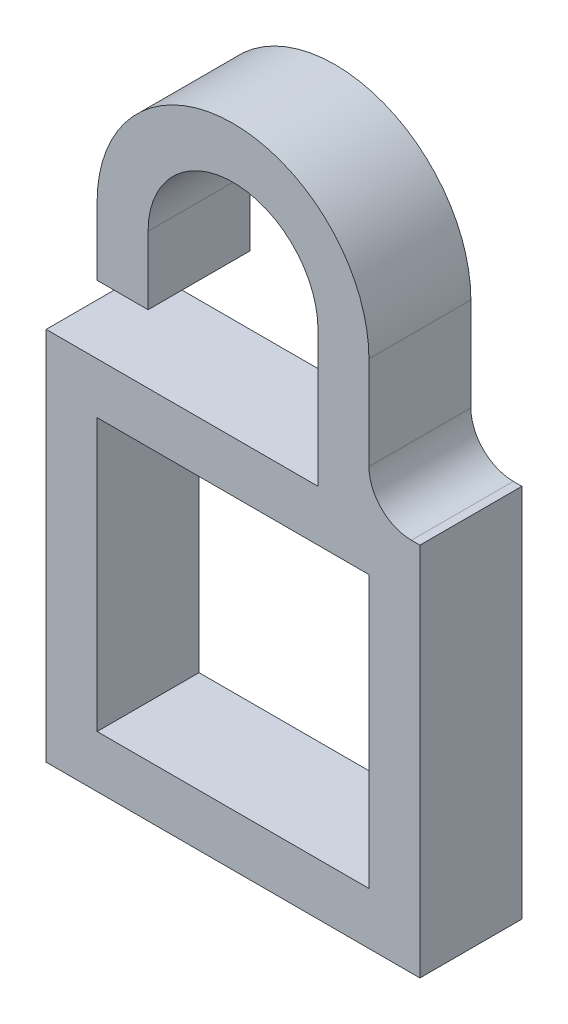
from build123d import *

# Parameters (mm, degrees)
EXTRUDE_1_DEPTH = 12
FILLET_1_R      = 5


with BuildPart() as part:
    # 草图1 → 凸台-拉伸1 (new body)
    with BuildSketch(Plane.XY):
        with BuildLine():
            Line((-16, -8), (-10, -8))
            Line((-10, -8), (-10, 0))
            ThreePointArc((-10, 0), (0, 10), (10, 0))
            Line((10, 0), (10, -16))
            Line((10, -16), (16, -16))
            Line((16, -16), (16, 0))
            ThreePointArc((16, 0), (0, 16), (-16, 0))
            Line((-16, 0), (-16, -8))
        make_face()
        Polygon((16, -16), (10, -16), (-10, -16), (-16, -16), (-22, -16), (-22, -54), (-16, -54), (-16, -22), (-10, -22), (10, -22), (16, -22), (16, -54), (22, -54), (22, -16), align=None)
        Polygon((16, -54), (22, -54), (22, -60.12975141), (-22, -60.12975141), (-22, -54), (-16, -54), align=None)
    extrude(amount=EXTRUDE_1_DEPTH)

    # 圆角1
    fillet_1_edges = [part.edges().sort_by_distance(p)[0] for p in [
        (16, -16, 6),
    ]]
    fillet(fillet_1_edges, radius=FILLET_1_R)


solid = part.part
